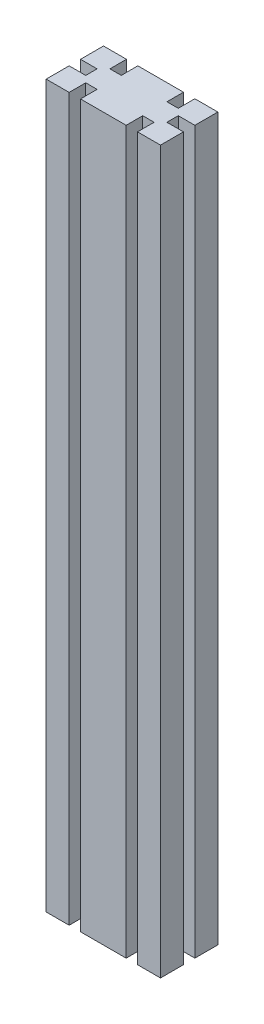
from build123d import *

# Parameters (mm, degrees)
BOSS_EXTRUDE1_DEPTH = 508


with BuildPart() as part:
    # Sketch1 → Boss-Extrude1 (new body)
    with BuildSketch(Plane(origin=(0, 0, 0), x_dir=(1, 0, 0), z_dir=(0, 1, 0))):
        Polygon((-24.075, 20.193), (-40.259, 20.193), (-40.259, 4), (-28.575, 4), (-28.575, -4), (-40.259, -4), (-40.259, -20.193), (-24.075, -20.193), (-24.075, -8.509), (-16.075, -8.509), (-16.075, -20.193), (16.075, -20.193), (16.075, -8.509), (24.075, -8.509), (24.075, -20.193), (40.259, -20.193), (40.259, -4), (28.575, -4), (28.575, 4), (40.259, 4), (40.259, 20.193), (24.075, 20.193), (24.075, 8.509), (16.075, 8.509), (16.075, 20.193), (-16.075, 20.193), (-16.075, 8.509), (-24.075, 8.509), align=None)
    extrude(amount=BOSS_EXTRUDE1_DEPTH)


solid = part.part
